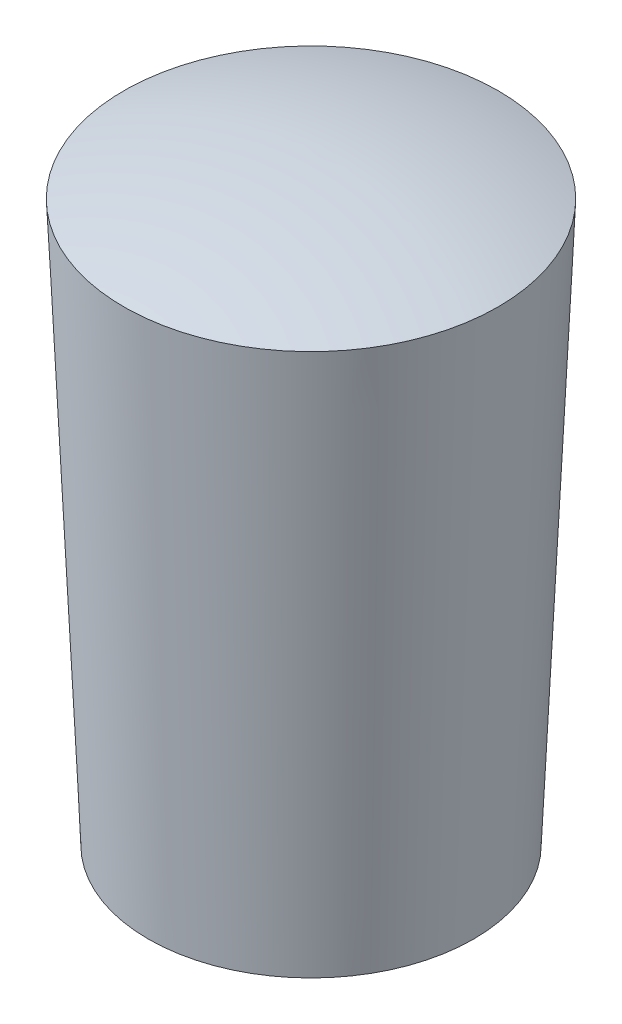
from build123d import *


with BuildPart() as part:
    # Base Sketch → Base (revolve)
    with BuildSketch(Plane.XY, mode=Mode.PRIVATE) as base_sk:
        with BuildLine():
            ThreePointArc((0, 30.55), (4.908765365, 30.15305163), (9.689967626, 28.972521937))
            Line((9.689967626, 28.972521937), (8.425, 0))
            Line((8.425, 0), (7.575809012, 0.037076479))
            Line((7.575809012, 0.037076479), (8.812522207, 28.362465555))
            ThreePointArc((8.812522207, 28.362465555), (4.456723742, 29.363712529), (0, 29.7))
            Line((0, 29.7), (0, 30.55))
        make_face()
    revolve(base_sk.sketch.rotate(Axis((0, 0, 0), (0, 1, 0)), 90), axis=Axis((0, 0, 0), (0, 1, 0)))


solid = part.part
